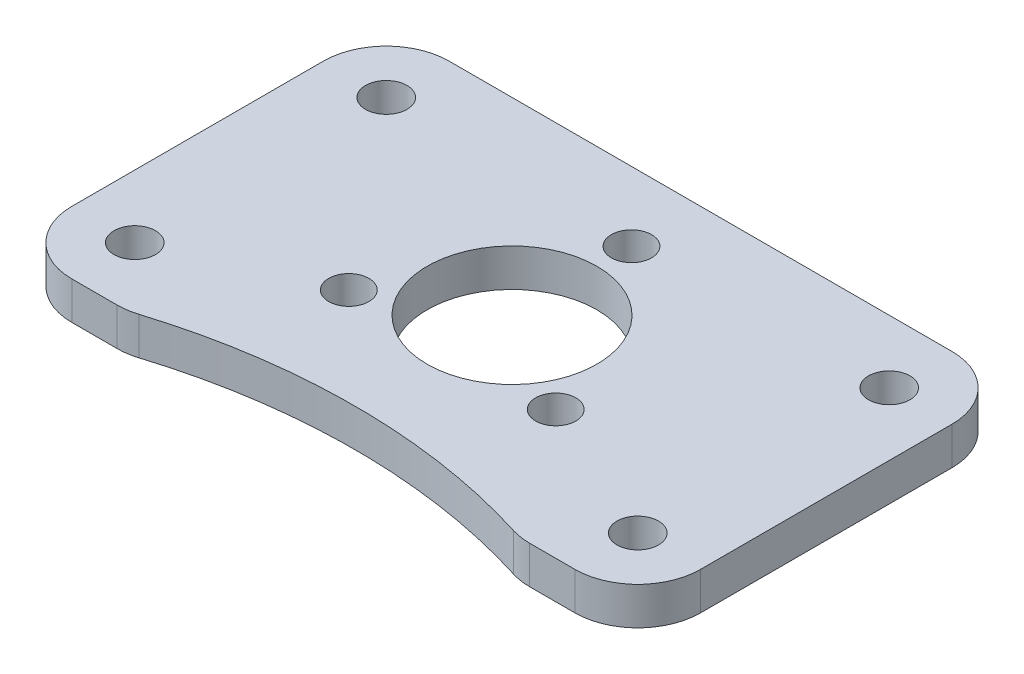
from build123d import *

# Parameters (mm, degrees)
SKETCH_1_R      = 1.65
SKETCH_1_R_2    = 6.75
SKETCH_1_R_3    = 1.6
EXTRUDE_1_DEPTH = 3
FILLET_1_R      = 5


with BuildPart() as part:
    # ｽｹｯﾁ1 → ﾎﾞｽ - 押し出し1 (new body)
    with BuildSketch(Plane(origin=(0, 0, 0), x_dir=(1, 0, 0), z_dir=(0, 1, 0))):
        with BuildLine():
            Line((0, 0), (9.387505004, 0))
            ThreePointArc((9.387505004, 0), (25, 2.5), (40.612494996, 0))
            Line((40.612494996, 0), (50, 0))
            Line((50, 0), (50, 30))
            Line((50, 30), (0, 30))
            Line((0, 30), (0, 0))
        make_face()
        with Locations(Location((45, 5, 0), (0, 0, 270))):
            Circle(SKETCH_1_R, mode=Mode.SUBTRACT)
        with Locations(Location((5, 5, 0), (0, 0, 90))):
            Circle(SKETCH_1_R, mode=Mode.SUBTRACT)
        with Locations(Location((5, 25, 0), (0, 0, 270))):
            Circle(SKETCH_1_R, mode=Mode.SUBTRACT)
        with Locations(Location((45, 25, 0), (0, 0, 90))):
            Circle(SKETCH_1_R, mode=Mode.SUBTRACT)
        with Locations(Location((25, 15, 0), (0, 0, 270))):
            Circle(SKETCH_1_R_2, mode=Mode.SUBTRACT)
        with Locations(Location((25, 24.5, 0), (0, 0, 270))):
            Circle(SKETCH_1_R_3, mode=Mode.SUBTRACT)
        with Locations(Location((33.227241336, 10.25, 0), (0, 0, 270))):
            Circle(SKETCH_1_R_3, mode=Mode.SUBTRACT)
        with Locations(Location((16.772758664, 10.25, 0), (0, 0, 270))):
            Circle(SKETCH_1_R_3, mode=Mode.SUBTRACT)
    extrude(amount=EXTRUDE_1_DEPTH)

    # ﾌｨﾚｯﾄ1
    fillet_1_edges = [part.edges().sort_by_distance(p)[0] for p in [
        (0, 1.5, -30),
        (50, 1.5, -30),
        (50, 1.5, 0),
        (40.612494996, 1.5, 0),
        (9.387505004, 1.5, 0),
        (0, 1.5, 0),
    ]]
    fillet(fillet_1_edges, radius=FILLET_1_R)


solid = part.part
